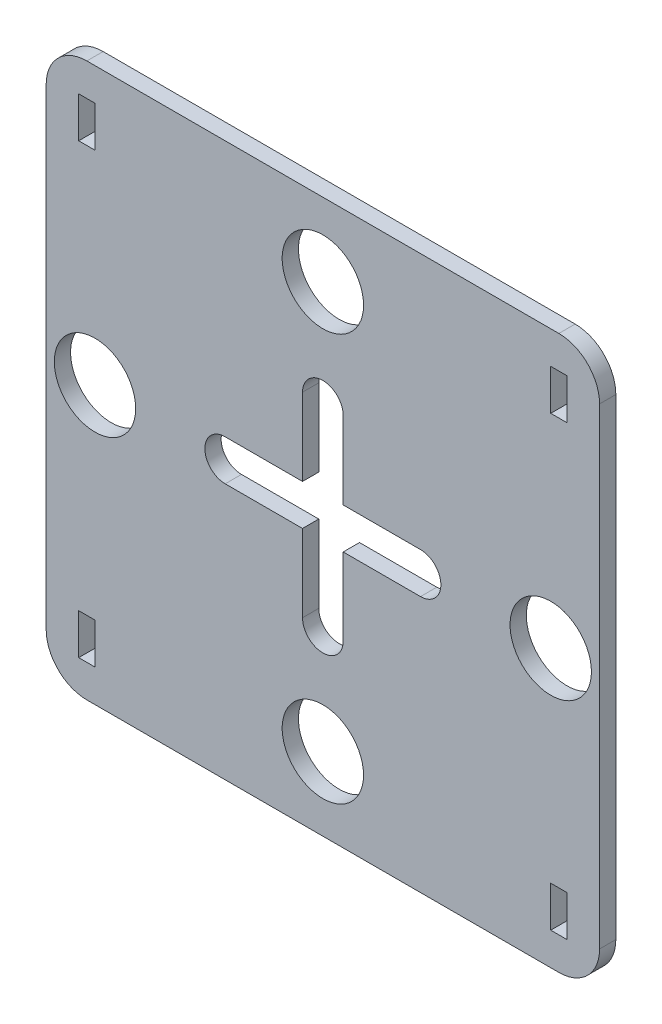
from build123d import *

# Parameters (mm, degrees)
SKETCH1_W           = 68
SKETCH1_H           = 68
SKETCH1_W_2         = 2
SKETCH1_H_2         = 5
SKETCH1_R           = 5
BOSS_EXTRUDE1_DEPTH = 2
FILLET2_R           = 5
FILLET3_R           = 5
FILLET4_R           = 5
FILLET5_R           = 5


with BuildPart() as part:
    # Sketch1 → Boss-Extrude1 (new body)
    with BuildSketch(Plane.XY):
        Rectangle(SKETCH1_W, SKETCH1_H)
        with Locations((-29, -27.5)):
            Rectangle(SKETCH1_W_2, SKETCH1_H_2, mode=Mode.SUBTRACT)
        with Locations((0, -25)):
            Circle(SKETCH1_R, mode=Mode.SUBTRACT)
        with Locations((29, -27.5)):
            Rectangle(SKETCH1_W_2, SKETCH1_H_2, mode=Mode.SUBTRACT)
        with Locations((-28, 0)):
            Circle(SKETCH1_R, mode=Mode.SUBTRACT)
        with Locations((-29, 27.5)):
            Rectangle(SKETCH1_W_2, SKETCH1_H_2, mode=Mode.SUBTRACT)
        with BuildLine():
            ThreePointArc((-12, -2.5), (-14.5, 0), (-12, 2.5))
            Line((-12, 2.5), (-2.5, 2.5))
            Line((-2.5, 2.5), (-2.5, 12))
            ThreePointArc((-2.5, 12), (0, 14.5), (2.5, 12))
            Line((2.5, 12), (2.5, 2.5))
            Line((2.5, 2.5), (12, 2.5))
            ThreePointArc((12, 2.5), (14.5, 0), (12, -2.5))
            Line((12, -2.5), (2.5, -2.5))
            Line((2.5, -2.5), (2.5, -12))
            ThreePointArc((2.5, -12), (0, -14.5), (-2.5, -12))
            Line((-2.5, -12), (-2.5, -2.5))
            Line((-2.5, -2.5), (-12, -2.5))
        make_face(mode=Mode.SUBTRACT)
        with Locations((28, 0)):
            Circle(SKETCH1_R, mode=Mode.SUBTRACT)
        with Locations((0, 25)):
            Circle(SKETCH1_R, mode=Mode.SUBTRACT)
        with Locations((29, 27.5)):
            Rectangle(SKETCH1_W_2, SKETCH1_H_2, mode=Mode.SUBTRACT)
    extrude(amount=BOSS_EXTRUDE1_DEPTH)

    # Fillet2
    fillet2_edges = [part.edges().sort_by_distance(p)[0] for p in [
        (34, 34, 1),
    ]]
    fillet(fillet2_edges, radius=FILLET2_R)

    # Fillet3
    fillet3_edges = [part.edges().sort_by_distance(p)[0] for p in [
        (-34, 34, 1),
    ]]
    fillet(fillet3_edges, radius=FILLET3_R)

    # Fillet4
    fillet4_edges = [part.edges().sort_by_distance(p)[0] for p in [
        (-34, -34, 1),
    ]]
    fillet(fillet4_edges, radius=FILLET4_R)

    # Fillet5
    fillet5_edges = [part.edges().sort_by_distance(p)[0] for p in [
        (34, -34, 1),
    ]]
    fillet(fillet5_edges, radius=FILLET5_R)


solid = part.part
